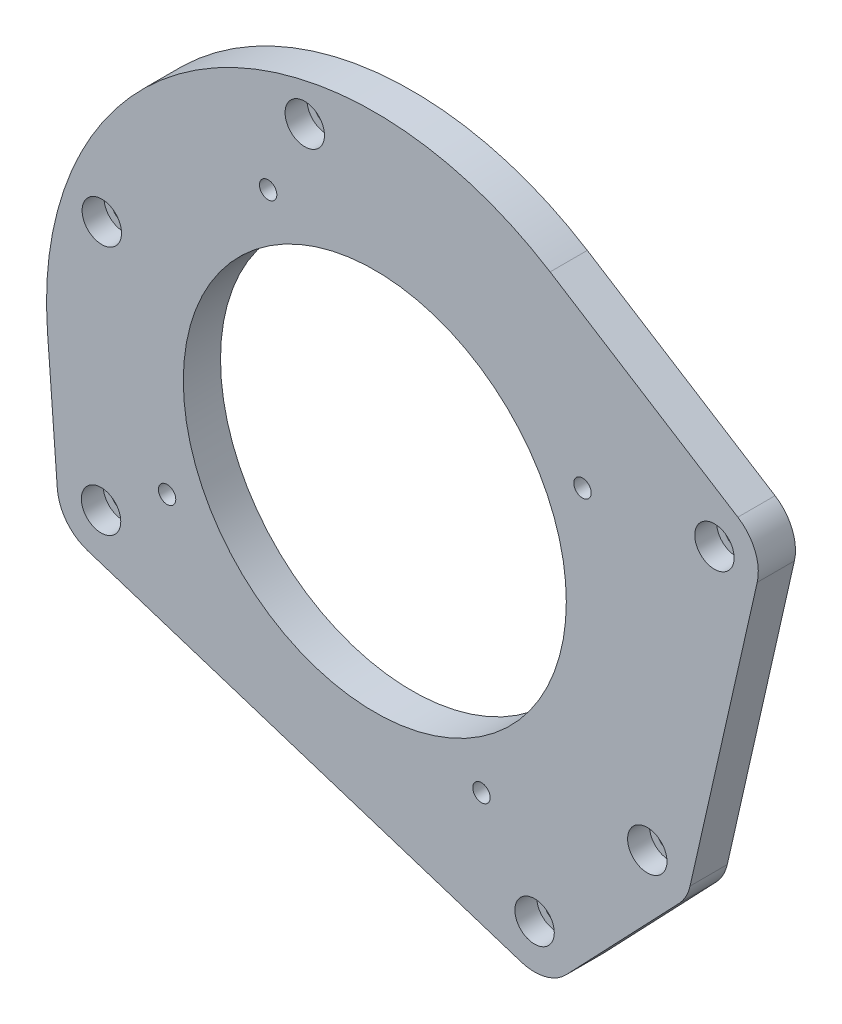
from build123d import *

# Parameters (mm, degrees)
SKETCH1_R                       = 4
SKETCH1_R_2                     = 87.5
BOSS_EXTRUDE1_DEPTH             = 17
CBORE_FOR_M10_SHCS1_D           = 11
CBORE_FOR_M10_SHCS1_CBORE_D     = 18
CBORE_FOR_M10_SHCS1_CBORE_DEPTH = 10
F_3_8_16_TAPPED_HOLE3_D         = 7.9375


with BuildPart() as part:
    # Sketch1 → Boss-Extrude1 (new body)
    with BuildSketch(Plane.XY):
        with BuildLine():
            Line((-131.19643785, -89.124723518), (66.8670709, -152.795612062))
            ThreePointArc((66.8670709, -152.795612062), (77.933659306, -153.140329428), (87.494178001, -147.556003928))
            Line((87.494178001, -147.556003928), (138.994178001, -93.615245818))
            ThreePointArc((138.994178001, -93.615245818), (142.158380517, -89.25120713), (144.044882633, -84.201640712))
            Line((144.044882633, -84.201640712), (174.718661169, 51.290400995))
            ThreePointArc((174.718661169, 51.290400995), (173.689671163, 63.379486111), (165.873431227, 72.659097776))
            Line((165.873431227, 72.659097776), (80.089309433, 126.829422905))
            ThreePointArc((80.089309433, 126.829422905), (-77.284768492, 128.557631275), (-149.578321741, -11.239469072))
            Line((-149.578321741, -11.239469072), (-145.046651368, -71.548336401))
            ThreePointArc((-145.046651368, -71.548336401), (-140.803414929, -82.449846894), (-131.19643785, -89.124723518))
        make_face()
        with Locations((-125.063508749, -70.046782494)):
            Circle(SKETCH1_R, mode=Mode.SUBTRACT)
        with Locations((73.000000001, -133.717671038)):
            Circle(SKETCH1_R, mode=Mode.SUBTRACT)
        with Locations((124.500000001, -79.776912929)):
            Circle(SKETCH1_R, mode=Mode.SUBTRACT)
        with Locations((155.173778537, 55.715128778)):
            Circle(SKETCH1_R, mode=Mode.SUBTRACT)
        with Locations((-32, 129.301071167)):
            Circle(SKETCH1_R, mode=Mode.SUBTRACT)
        Circle(SKETCH1_R_2, mode=Mode.SUBTRACT)
        with Locations((-124.734461308, 44.232368469)):
            Circle(SKETCH1_R, mode=Mode.SUBTRACT)
    extrude(amount=BOSS_EXTRUDE1_DEPTH)

    # CBORE for M10 SHCS1 (through all)
    with Locations(Plane(origin=(-124.734461308, 44.232368469, 17), x_dir=(1, 0, 0), z_dir=(0, 0, 1))):
        with Locations((0, 0), (92.734461308, 85.068702698), (279.908239845, 11.482760309), (249.234461309, -124.009281398), (197.734461309, -177.950039507), (-0.329047441, -114.279150963)):
            CounterBoreHole(CBORE_FOR_M10_SHCS1_D / 2, CBORE_FOR_M10_SHCS1_CBORE_D / 2, CBORE_FOR_M10_SHCS1_CBORE_DEPTH)

    # 3/8-16 Tapped Hole3 (through all)
    with Locations(Plane(origin=(-48.728615608, 94.900708221, 17), x_dir=(1, 0, 0), z_dir=(0, 0, 1))):
        with Locations((0, 0), (143.629323829, -46.172092613), (97.457231216, -189.801416442), (-46.172092613, -143.629323829)):
            Hole(F_3_8_16_TAPPED_HOLE3_D / 2)


solid = part.part
